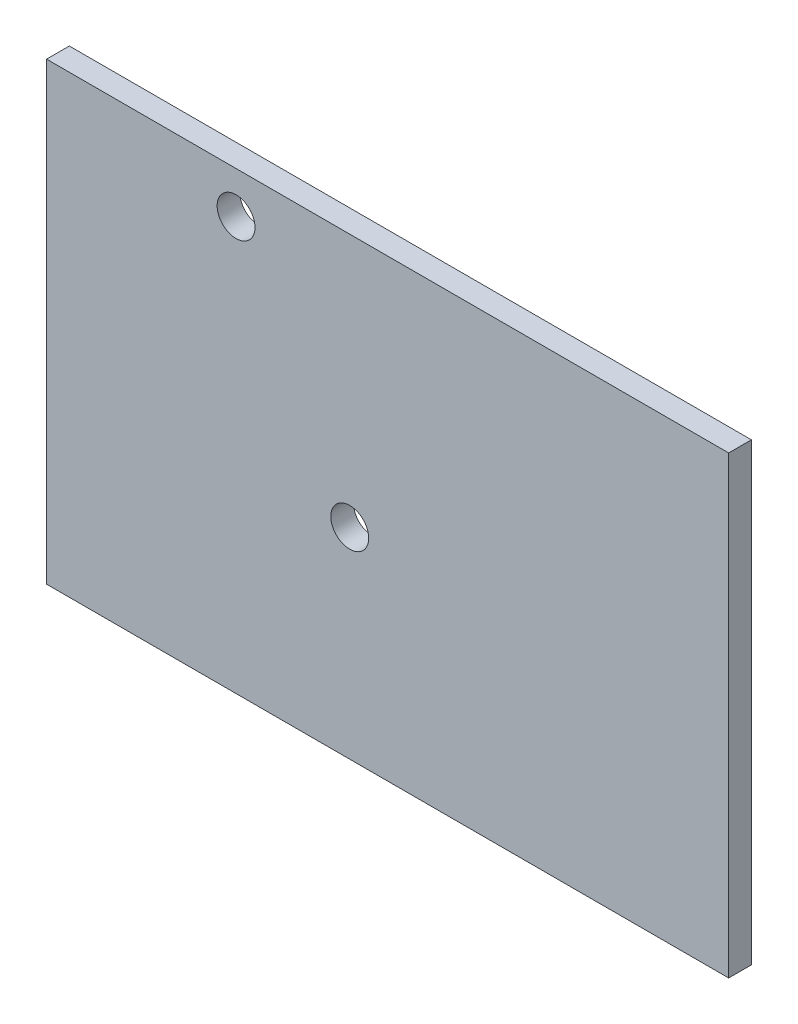
from build123d import *

# Parameters (mm, degrees)
SKETCH_1_W      = 90
SKETCH_1_H      = 60
SKETCH_1_R      = 2.5
EXTRUDE_1_DEPTH = 3


with BuildPart() as part:
    # 스케치1 → 보스-돌출1 (new body)
    with BuildSketch(Plane.XY):
        Rectangle(SKETCH_1_W, SKETCH_1_H)
        with Locations((-20, 24.5)):
            Circle(SKETCH_1_R, mode=Mode.SUBTRACT)
        with Locations((-5, -3.5)):
            Circle(SKETCH_1_R, mode=Mode.SUBTRACT)
    extrude(amount=EXTRUDE_1_DEPTH)


solid = part.part
